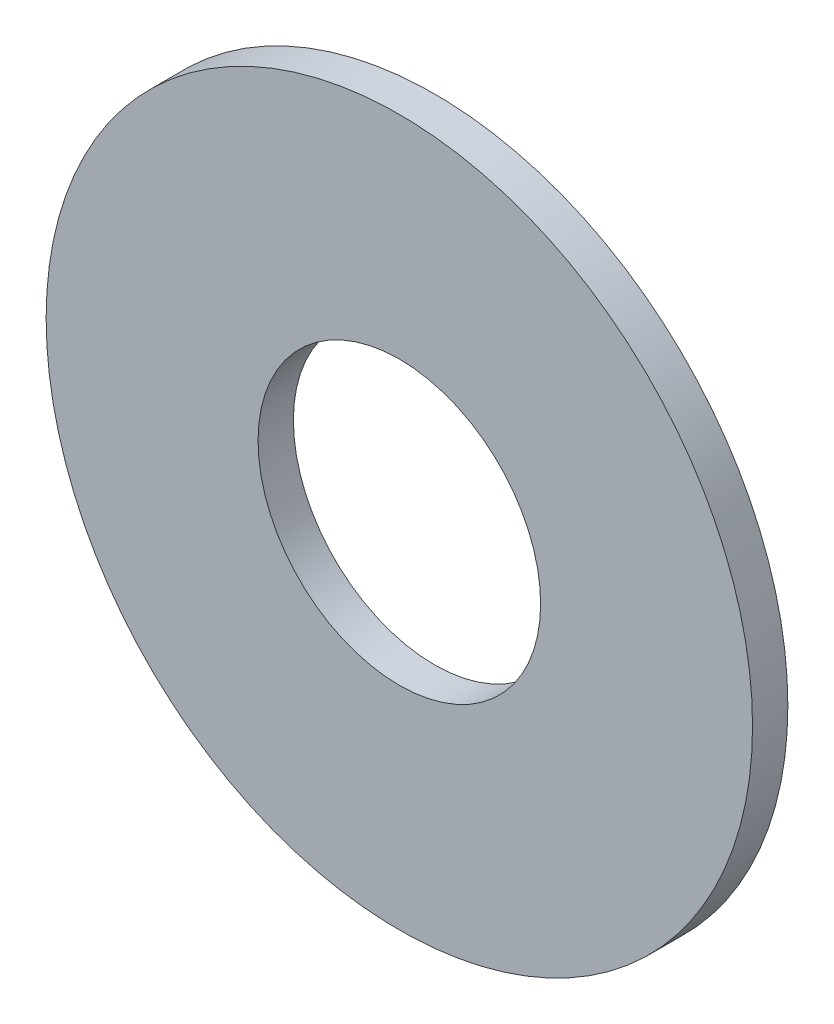
from build123d import *

# Parameters (mm, degrees)
SKETCH1_R           = 10
SKETCH1_R_2         = 4
BOSS_EXTRUDE1_DEPTH = 1


with BuildPart() as part:
    # Sketch1 → Boss-Extrude1 (new body)
    with BuildSketch(Plane.XY):
        Circle(SKETCH1_R)
        Circle(SKETCH1_R_2, mode=Mode.SUBTRACT)
    extrude(amount=BOSS_EXTRUDE1_DEPTH)


solid = part.part
